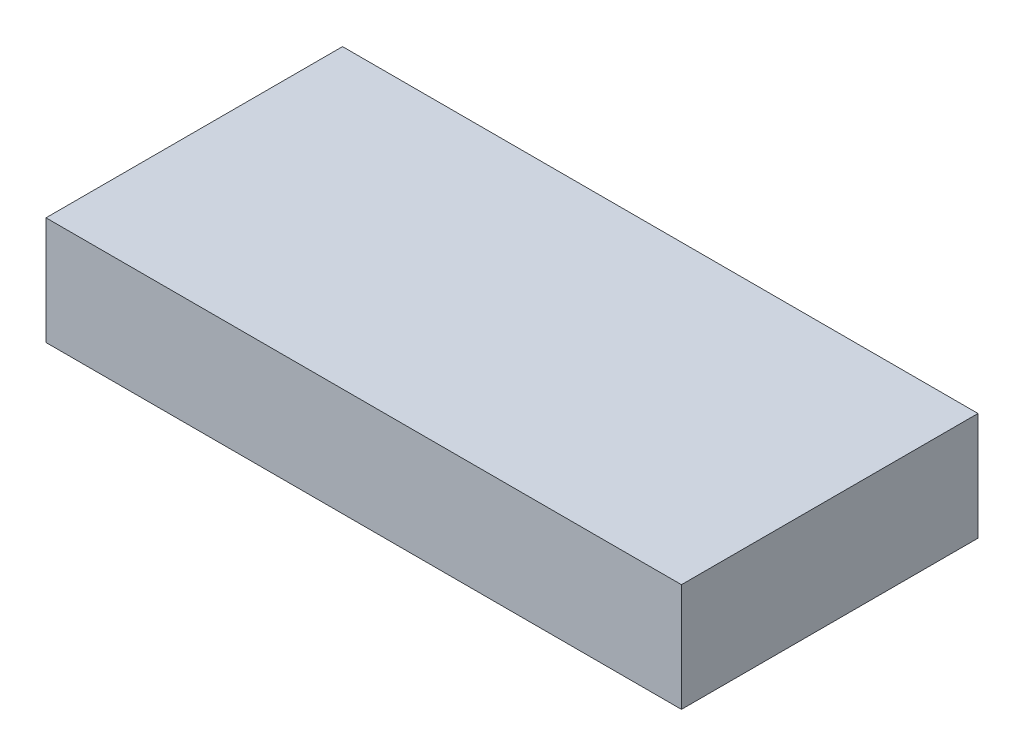
from build123d import *

# Parameters (mm, degrees)
SKETCH_2_W      = 60
SKETCH_2_H      = 28
EXTRUDE_1_DEPTH = 10.2
SKETCH_3_R      = 7
EXTRUDE_2_DEPTH = 2.4


with BuildPart() as part:
    # 草图2 → 凸台-拉伸1 (new body)
    with BuildSketch(Plane(origin=(0, 0, 0), x_dir=(1, 0, 0), z_dir=(0, 1, 0))):
        with Locations((10.280701754, -4.807017544)):
            Rectangle(SKETCH_2_W, SKETCH_2_H)
    extrude(amount=EXTRUDE_1_DEPTH)

    # 草图3 → 凸台-拉伸2 (add)
    with BuildSketch(Plane.XZ):
        with Locations(Location((21.280701754, 4.807017544, 0), (0, 0, 270))):
            Circle(SKETCH_3_R)
    extrude(amount=EXTRUDE_2_DEPTH)


solid = part.part
